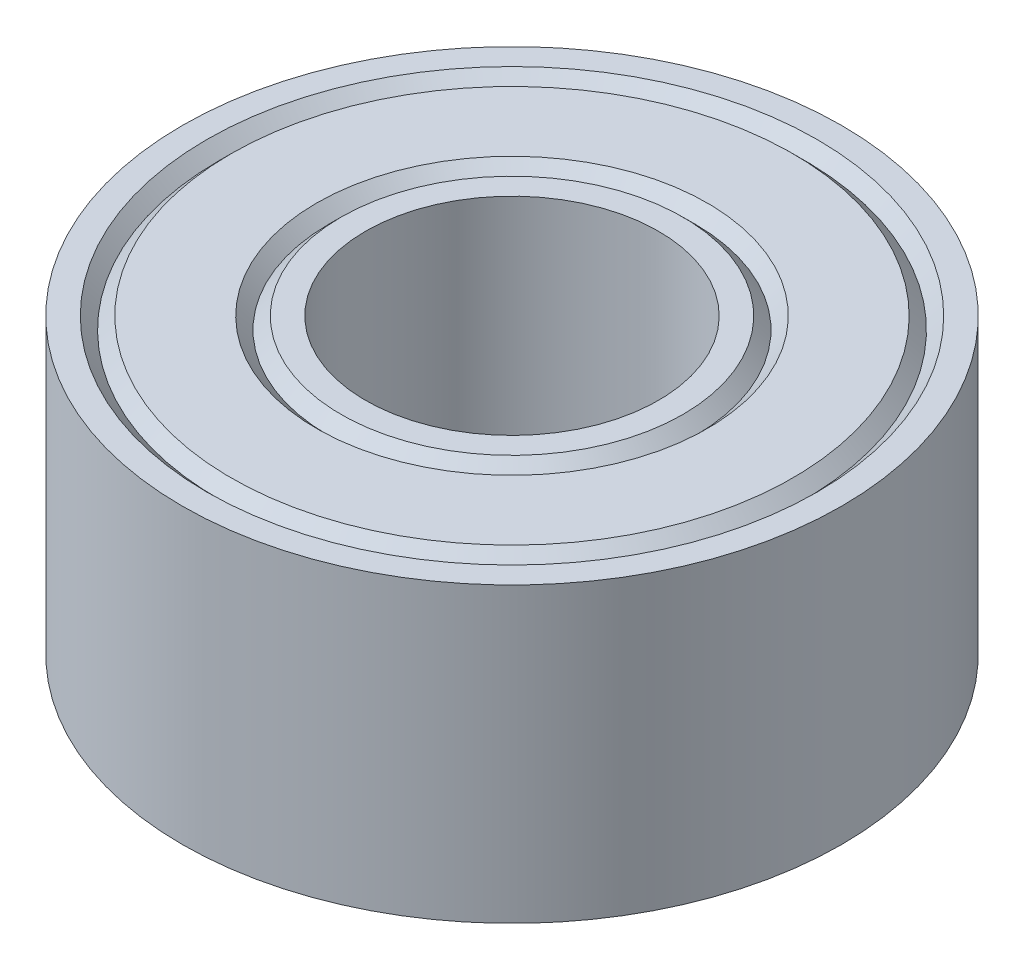
from build123d import *


with BuildPart() as part:
    # Sketch1 → Revolve1 (revolve)
    with BuildSketch(Plane.XY):
        Polygon((-2, 2), (-2.333333333, 2), (-2.5, 1.833333333), (-2.666666667, 2), (-3.833333333, 2), (-4, 1.833333333), (-4.166666667, 2), (-4.5, 2), (-4.5, -2), (-4.166666667, -2), (-4, -1.833333333), (-3.833333333, -2), (-2.666666667, -2), (-2.5, -1.833333333), (-2.333333333, -2), (-2, -2), align=None)
    revolve(axis=Axis((0, 2, 0), (0, -1, 0)))


solid = part.part
